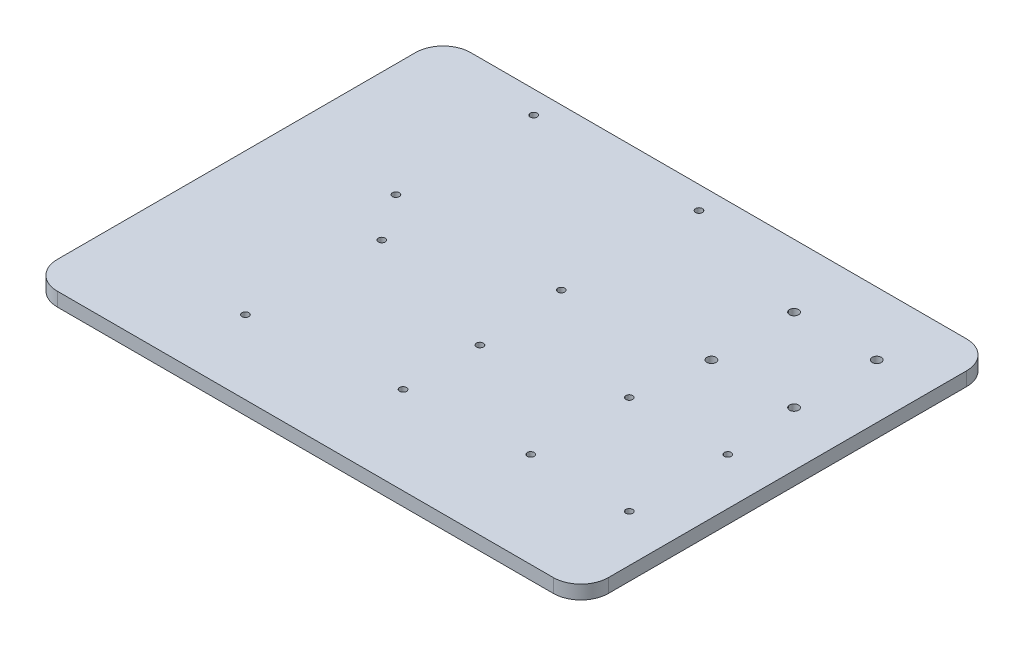
from build123d import *

# Parameters (mm, degrees)
BOSS_EXTRUDE1_DEPTH            = 5
ARDUINO_UNO_HOLES_D            = 2.5
L298N_HOLES_D                  = 2.5
MOTOR_MOUNTING_BRACKET_HOLES_D = 3.3
PROTOBOARD_HOLES_D             = 2.5


with BuildPart() as part:
    # Sketch1 → Boss-Extrude1 (new body)
    with BuildSketch(Plane(origin=(0, 0, 0), x_dir=(1, 0, 0), z_dir=(0, 1, 0))):
        with BuildLine():
            Line((-90, -75), (90, -75))
            ThreePointArc((90, -75), (97.071067812, -72.071067812), (100, -65))
            Line((100, -65), (100, 65))
            ThreePointArc((100, 65), (97.071067812, 72.071067812), (90, 75))
            Line((90, 75), (-90, 75))
            ThreePointArc((-90, 75), (-97.071067812, 72.071067812), (-100, 65))
            Line((-100, 65), (-100, -65))
            ThreePointArc((-100, -65), (-97.071067812, -72.071067812), (-90, -75))
        make_face()
    extrude(amount=BOSS_EXTRUDE1_DEPTH)

    # arduino uno holes (through all)
    with Locations(Plane(origin=(0, 5, 0), x_dir=(1, 0, 0), z_dir=(0, 1, 0))):
        with Locations((3.609044644, -15.249784892), (3.609044644, -43.149784892), (-47.190955356, -0.049784892), (-48.490955356, -48.249784892)):
            Hole(ARDUINO_UNO_HOLES_D / 2)

    # l298n holes (through all)
    with Locations(Plane(origin=(0, 5, 0), x_dir=(1, 0, 0), z_dir=(0, 1, 0))):
        with Locations((47.201873377, -40.409180512), (82.961873377, -40.409180512), (82.961873377, -4.649180512), (47.201873377, -4.649180512)):
            Hole(L298N_HOLES_D / 2)

    # motor mounting bracket holes (through all)
    with Locations(Plane(origin=(0, 5, 0), x_dir=(1, 0, 0), z_dir=(0, 1, 0))):
        with Locations((50.273035044, 22.097798604), (80.273035044, 22.097798604), (80.273035044, 52.097798604), (50.273035044, 52.097798604)):
            Hole(MOTOR_MOUNTING_BRACKET_HOLES_D / 2)

    # protoboard holes (through all)
    with Locations(Plane(origin=(0, 5, 0), x_dir=(1, 0, 0), z_dir=(0, 1, 0))):
        with Locations((-58.909900465, 16.774792285), (1.090099535, 16.774792285), (1.090099535, 66.774792285), (-58.909900465, 66.774792285)):
            Hole(PROTOBOARD_HOLES_D / 2)


solid = part.part
